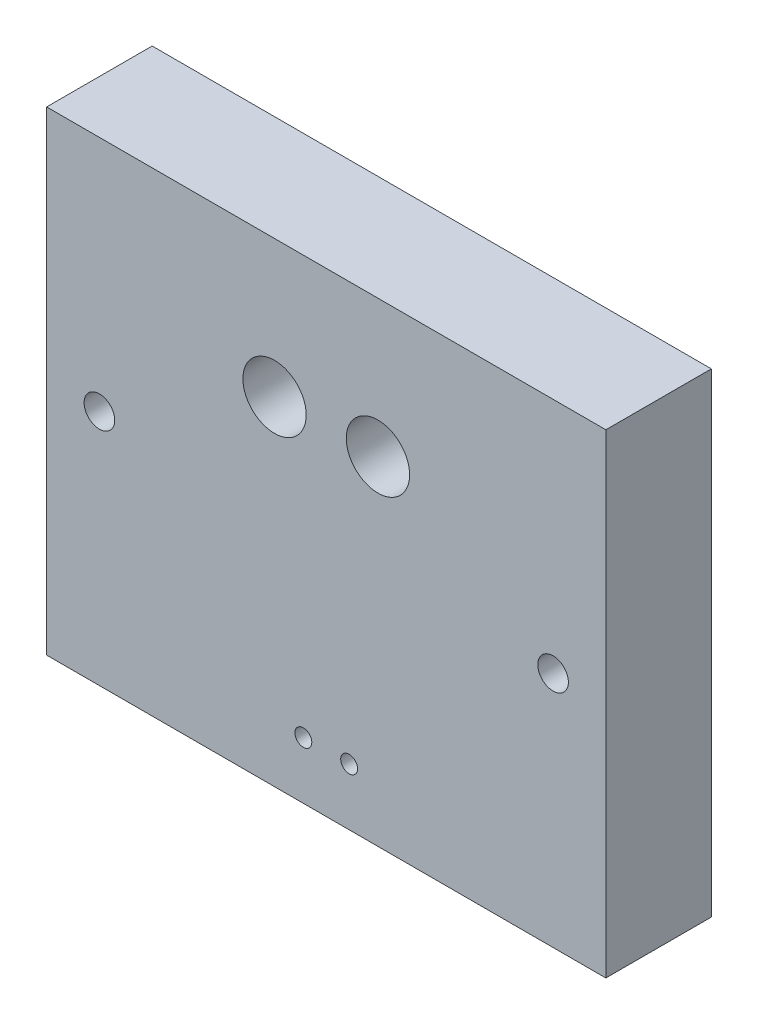
from build123d import *

# Parameters (mm, degrees)
CROQUIS1_W              = 53
CROQUIS1_H              = 45
SALIENTE_EXTRUIR1_DEPTH = 10
CROQUIS2_R              = 0.8
CORTAR_EXTRUIR1_DEPTH   = 10
CROQUIS3_R              = 1.45
CORTAR_EXTRUIR2_DEPTH   = 10
CROQUIS4_R              = 3
CORTAR_EXTRUIR3_DEPTH   = 5
CROQUIS5_R              = 1.45
CORTAR_EXTRUIR4_DEPTH   = 10


with BuildPart() as part:
    # Croquis1 → Saliente-Extruir1 (new body)
    with BuildSketch(Plane.XY):
        with Locations((8.456656727, -2.798833819)):
            Rectangle(CROQUIS1_W, CROQUIS1_H)
    extrude(amount=SALIENTE_EXTRUIR1_DEPTH)

    # Croquis2 → Cortar-Extruir1 (cut)
    with BuildSketch(Plane.XY.offset(10)):
        with Locations((6.286656727, -19.898833819)):
            Circle(CROQUIS2_R)
        with Locations((10.626656727, -19.898833819)):
            Circle(CROQUIS2_R)
    extrude(amount=-CORTAR_EXTRUIR1_DEPTH, mode=Mode.SUBTRACT)

    # Croquis3 → Cortar-Extruir2 (cut)
    with BuildSketch(Plane.XY.offset(10)):
        with Locations((13.356656727, 6.701166181)):
            Circle(CROQUIS3_R)
        with Locations((3.556656727, 6.701166181)):
            Circle(CROQUIS3_R)
    extrude(amount=-CORTAR_EXTRUIR2_DEPTH, mode=Mode.SUBTRACT)

    # Croquis4 → Cortar-Extruir3 (cut)
    with BuildSketch(Plane.XY.offset(10)):
        with Locations((3.556656727, 6.701166181)):
            Circle(CROQUIS4_R)
        with Locations((13.356656727, 6.701166181)):
            Circle(CROQUIS4_R)
    extrude(amount=-CORTAR_EXTRUIR3_DEPTH, mode=Mode.SUBTRACT)

    # Croquis5 → Cortar-Extruir4 (cut)
    with BuildSketch(Plane.XY.offset(10)):
        with Locations((-13.043343273, -2.798833819)):
            Circle(CROQUIS5_R)
        with Locations(Location((29.956656727, -2.798833819, 0), (0, 0, 180))):
            Circle(CROQUIS5_R)
    extrude(amount=-CORTAR_EXTRUIR4_DEPTH, mode=Mode.SUBTRACT)


solid = part.part
